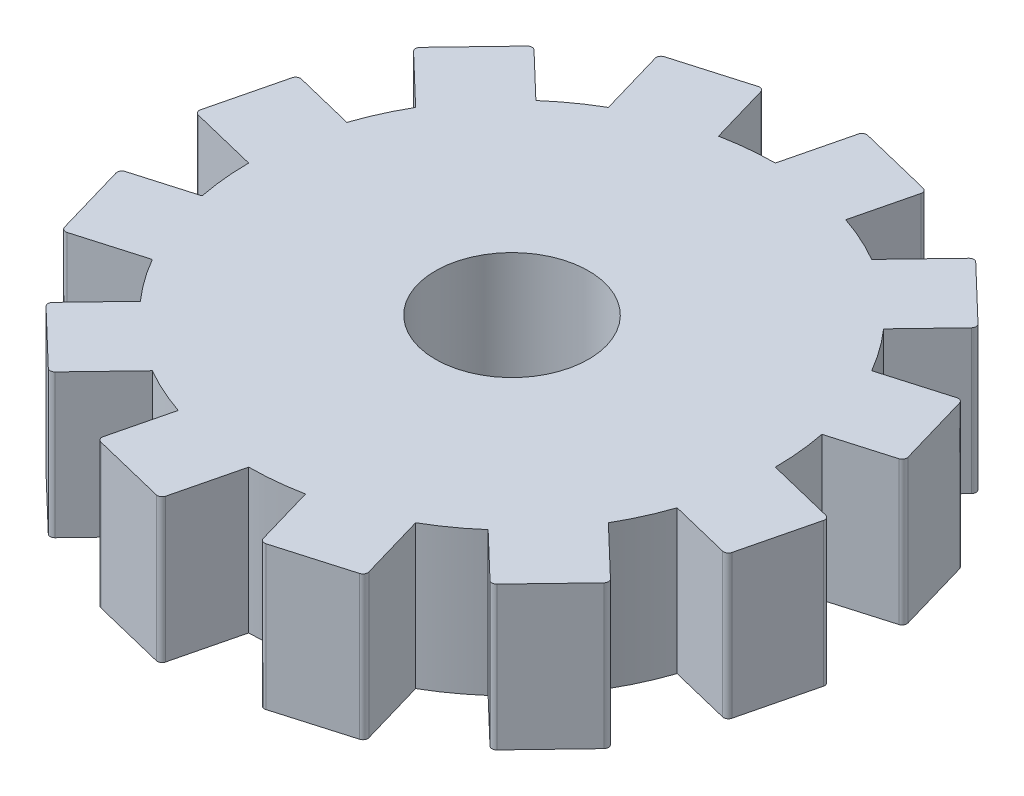
from build123d import *

# Parameters (mm, degrees)
SKETCH1_R               = 7
BOSS_EXTRUDE1_DEPTH     = 3
CUT_EXTRUDE1_DEPTH      = 11.344080433
CUT_EXTRUDE1_DEPTH_BACK = 3
SKETCH5_R               = 1.6
CUT_EXTRUDE2_DEPTH      = 3


with BuildPart() as part:
    # Sketch1 → Boss-Extrude1 (new body)
    with BuildSketch(Plane(origin=(0, 0, 0), x_dir=(1, 0, 0), z_dir=(0, 1, 0))):
        with Locations(Location((0, 0, 0), (0, 0, 270))):
            Circle(SKETCH1_R)
    extrude(amount=BOSS_EXTRUDE1_DEPTH)

    # Sketch2 → Cut-Extrude1 (cut, two sides: drawn at the far end of the back side and taken through both)
    with BuildSketch(Plane(origin=(0, 3, 0), x_dir=(1, 0, 0), z_dir=(0, 1, 0)).offset(-CUT_EXTRUDE1_DEPTH_BACK)):
        with BuildLine():
            ThreePointArc((-1.079936716, 5.392933959), (-0.542615529, 5.473168039), (0, 5.5))
            Line((0, 5.5), (0, 7))
            ThreePointArc((0, 7), (-7, 0), (0, -7))
            Line((0, -7), (0, -5.5))
            Line((0, -5.5), (-0.341646298, -6.893330445))
            ThreePointArc((-0.341646298, -6.893330445), (-0.386932449, -6.955031571), (-0.462583878, -6.966638711))
            Line((-0.462583878, -6.966638711), (-1.996653446, -6.590483011))
            ThreePointArc((-1.996653446, -6.590483011), (-2.058354572, -6.54519686), (-2.069961712, -6.469545431))
            Line((-2.069961712, -6.469545431), (-1.761214349, -5.210386168))
            ThreePointArc((-1.761214349, -5.210386168), (-2.266665187, -5.011210326), (-2.75, -4.763139721))
            Line((-2.75, -4.763139721), (-3.742539596, -5.798976134))
            ThreePointArc((-3.742539596, -5.798976134), (-3.812609116, -5.8297678), (-3.883928745, -5.801994164))
            Line((-3.883928745, -5.801994164), (-5.024394113, -4.709198988))
            ThreePointArc((-5.024394113, -4.709198988), (-5.055185779, -4.639129468), (-5.027412143, -4.567809838))
            Line((-5.027412143, -4.567809838), (-4.130449452, -3.63171961))
            ThreePointArc((-4.130449452, -3.63171961), (-4.468594797, -3.206502852), (-4.763139721, -2.75))
            Line((-4.763139721, -2.75), (-6.140622431, -3.15079085))
            ThreePointArc((-6.140622431, -3.15079085), (-6.216700249, -3.142422455), (-6.264578041, -3.082709966))
            Line((-6.264578041, -3.082709966), (-6.705852434, -1.566088898))
            ThreePointArc((-6.705852434, -1.566088898), (-6.69748404, -1.490011081), (-6.63777155, -1.442133288))
            Line((-6.63777155, -1.442133288), (-5.392933959, -1.079936716))
            ThreePointArc((-5.392933959, -1.079936716), (-5.473168039, -0.542615529), (-5.5, 0))
            Line((-5.5, 0), (-6.893330445, 0.341646298))
            ThreePointArc((-6.893330445, 0.341646298), (-6.955031571, 0.386932449), (-6.966638711, 0.462583878))
            Line((-6.966638711, 0.462583878), (-6.590483011, 1.996653446))
            ThreePointArc((-6.590483011, 1.996653446), (-6.54519686, 2.058354572), (-6.469545431, 2.069961712))
            Line((-6.469545431, 2.069961712), (-5.210386168, 1.761214349))
            ThreePointArc((-5.210386168, 1.761214349), (-5.011210326, 2.266665187), (-4.763139721, 2.75))
            Line((-4.763139721, 2.75), (-5.798976134, 3.742539596))
            ThreePointArc((-5.798976134, 3.742539596), (-5.8297678, 3.812609116), (-5.801994164, 3.883928745))
            Line((-5.801994164, 3.883928745), (-4.709198988, 5.024394113))
            ThreePointArc((-4.709198988, 5.024394113), (-4.639129468, 5.055185779), (-4.567809838, 5.027412143))
            Line((-4.567809838, 5.027412143), (-3.63171961, 4.130449452))
            ThreePointArc((-3.63171961, 4.130449452), (-3.206502852, 4.468594797), (-2.75, 4.763139721))
            Line((-2.75, 4.763139721), (-3.15079085, 6.140622431))
            ThreePointArc((-3.15079085, 6.140622431), (-3.142422455, 6.216700249), (-3.082709966, 6.264578041))
            Line((-3.082709966, 6.264578041), (-1.566088898, 6.705852434))
            ThreePointArc((-1.566088898, 6.705852434), (-1.490011081, 6.69748404), (-1.442133288, 6.63777155))
            Line((-1.442133288, 6.63777155), (-1.079936716, 5.392933959))
        make_face()
        with BuildLine():
            Line((0, 7), (0, 5.5))
            Line((0, 5.5), (0.341646298, 6.893330445))
            ThreePointArc((0.341646298, 6.893330445), (0.386932449, 6.955031571), (0.462583878, 6.966638711))
            Line((0.462583878, 6.966638711), (1.996653446, 6.590483011))
            ThreePointArc((1.996653446, 6.590483011), (2.058354572, 6.54519686), (2.069961712, 6.469545431))
            Line((2.069961712, 6.469545431), (1.761214349, 5.210386168))
            ThreePointArc((1.761214349, 5.210386168), (2.266665187, 5.011210326), (2.75, 4.763139721))
            Line((2.75, 4.763139721), (3.742539596, 5.798976134))
            ThreePointArc((3.742539596, 5.798976134), (3.812609116, 5.8297678), (3.883928745, 5.801994164))
            Line((3.883928745, 5.801994164), (5.024394113, 4.709198988))
            ThreePointArc((5.024394113, 4.709198988), (5.055185779, 4.639129468), (5.027412143, 4.567809838))
            Line((5.027412143, 4.567809838), (4.130449452, 3.63171961))
            ThreePointArc((4.130449452, 3.63171961), (4.468594797, 3.206502852), (4.763139721, 2.75))
            Line((4.763139721, 2.75), (6.140622431, 3.15079085))
            ThreePointArc((6.140622431, 3.15079085), (6.216700249, 3.142422455), (6.264578041, 3.082709966))
            Line((6.264578041, 3.082709966), (6.705852434, 1.566088898))
            ThreePointArc((6.705852434, 1.566088898), (6.69748404, 1.490011081), (6.63777155, 1.442133288))
            Line((6.63777155, 1.442133288), (5.392933959, 1.079936716))
            ThreePointArc((5.392933959, 1.079936716), (5.473168039, 0.542615529), (5.5, 0))
            Line((5.5, 0), (6.893330445, -0.341646298))
            ThreePointArc((6.893330445, -0.341646298), (6.955031571, -0.386932449), (6.966638711, -0.462583878))
            Line((6.966638711, -0.462583878), (6.590483011, -1.996653446))
            ThreePointArc((6.590483011, -1.996653446), (6.54519686, -2.058354572), (6.469545431, -2.069961712))
            Line((6.469545431, -2.069961712), (5.210386168, -1.761214349))
            ThreePointArc((5.210386168, -1.761214349), (5.011210326, -2.266665187), (4.763139721, -2.75))
            Line((4.763139721, -2.75), (5.798976134, -3.742539596))
            ThreePointArc((5.798976134, -3.742539596), (5.8297678, -3.812609116), (5.801994164, -3.883928745))
            Line((5.801994164, -3.883928745), (4.709198988, -5.024394113))
            ThreePointArc((4.709198988, -5.024394113), (4.639129468, -5.055185779), (4.567809838, -5.027412143))
            Line((4.567809838, -5.027412143), (3.63171961, -4.130449452))
            ThreePointArc((3.63171961, -4.130449452), (3.206502852, -4.468594797), (2.75, -4.763139721))
            Line((2.75, -4.763139721), (3.15079085, -6.140622431))
            ThreePointArc((3.15079085, -6.140622431), (3.142422455, -6.216700249), (3.082709966, -6.264578041))
            Line((3.082709966, -6.264578041), (1.566088898, -6.705852434))
            ThreePointArc((1.566088898, -6.705852434), (1.490011081, -6.69748404), (1.442133288, -6.63777155))
            Line((1.442133288, -6.63777155), (1.079936716, -5.392933959))
            ThreePointArc((1.079936716, -5.392933959), (0.542615529, -5.473168039), (0, -5.5))
            Line((0, -5.5), (0, -7))
            ThreePointArc((0, -7), (4.949747468, -4.949747468), (7, 0))
            ThreePointArc((7, 0), (4.949747468, 4.949747468), (0, 7))
        make_face()
    extrude(amount=CUT_EXTRUDE1_DEPTH + CUT_EXTRUDE1_DEPTH_BACK, mode=Mode.SUBTRACT)

    # Sketch5 → Cut-Extrude2 (cut)
    with BuildSketch(Plane(origin=(0, 3, 0), x_dir=(1, 0, 0), z_dir=(0, 1, 0))):
        with Locations(Location((0, 0, 0), (0, 0, 270))):
            Circle(SKETCH5_R)
    extrude(amount=-CUT_EXTRUDE2_DEPTH, mode=Mode.SUBTRACT)


solid = part.part
